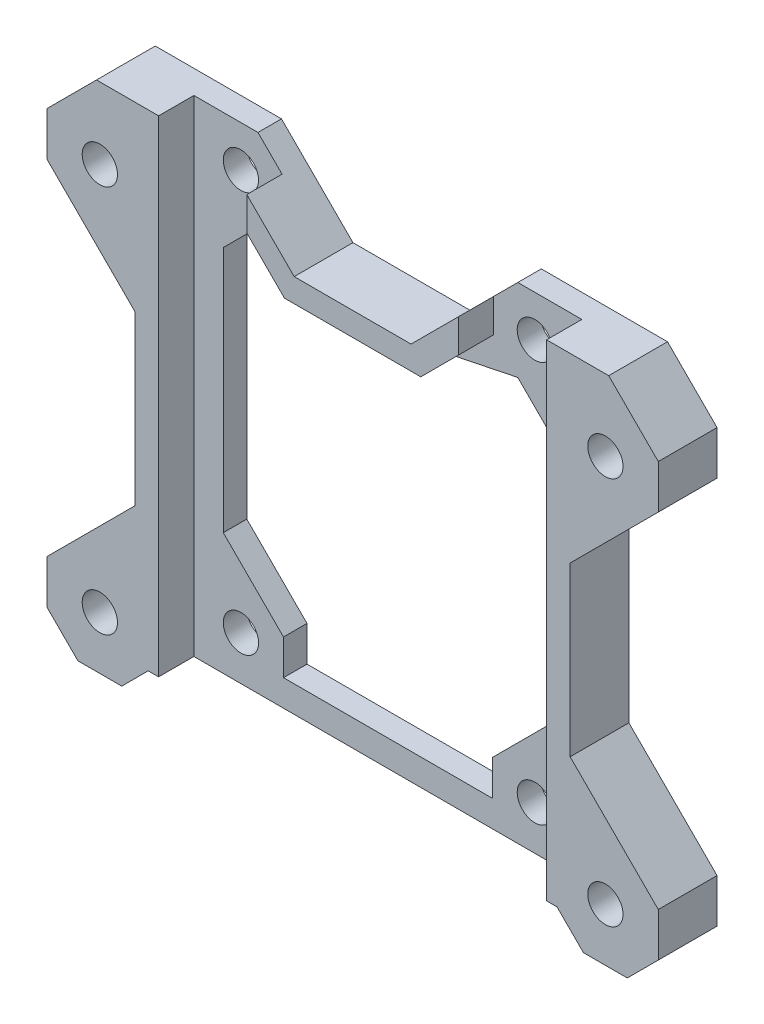
from build123d import *

# Parameters (mm, degrees)
SKETCH11_R          = 1.5
BOSS_EXTRUDE4_DEPTH = 2
SKETCH12_R          = 1.5
BOSS_EXTRUDE5_DEPTH = 3


with BuildPart() as part:
    # Sketch11 → Boss-Extrude4 (new body)
    with BuildSketch(Plane.XY):
        Polygon((16.5, -2.25), (-16.5, -2.25), (-17.386038969, -2.25), (-19.636038969, -4.5), (-23.363961031, -4.5), (-26, -1.863961031), (-26, 1.863961031), (-23.363961031, 4.5), (-18.5, 9.363961031), (-18.5, 23.636038969), (-23.363961031, 28.5), (-26, 31.136038969), (-26, 34.863961031), (-23.363961031, 37.5), (-21.784271247, 39.079689783), (-13.949747468, 39.079689783), (-11.050252532, 39.079689783), (-9, 37.029437252), (-4.970562748, 33), (4.970562748, 33), (9, 37.029437252), (11.050252532, 39.079689783), (13.949747468, 39.079689783), (21.784271247, 39.079689783), (23.363961031, 37.5), (26, 34.863961031), (26, 31.136038969), (23.363961031, 28.5), (18.5, 23.636038969), (18.5, 9.363961031), (23.363961031, 4.5), (26, 1.863961031), (26, -1.863961031), (23.363961031, -4.5), (19.636038969, -4.5), (17.386038969, -2.25), align=None)
        with Locations((-12.5, 1.5)):
            Circle(SKETCH11_R, mode=Mode.SUBTRACT)
        with Locations((-12.5, 35.579689783)):
            Circle(SKETCH11_R, mode=Mode.SUBTRACT)
        with Locations(Location((12.5, 35.579689783, 0), (0, 0, 180))):
            Circle(SKETCH11_R, mode=Mode.SUBTRACT)
        with Locations(Location((12.5, 1.5, 0), (0, 0, 180))):
            Circle(SKETCH11_R, mode=Mode.SUBTRACT)
        Polygon((8.878679656, 0), (-8.878679656, 0), (-8.878679656, 3), (-11, 5.121320344), (-14, 8.121320344), (-14, 29.129942315), (-11.050252532, 32.079689783), (-5.798989873, 31), (5.798989873, 31), (11.050252532, 32.079689783), (14, 29.129942315), (14, 8.121320344), (11, 5.121320344), (8.878679656, 3), align=None, mode=Mode.SUBTRACT)
    extrude(amount=BOSS_EXTRUDE4_DEPTH)

    # Sketch12 → Boss-Extrude5 (add)
    # profile 1 of 3: a face of its own
    with BuildSketch(Plane.XY.offset(2)):
        Polygon((-23.363961031, -4.5), (-19.636038969, -4.5), (-17.386038969, -2.25), (-16.5, -2.25), (-16.5, 39.079689783), (-21.784271247, 39.079689783), (-26, 34.863961031), (-26, 31.136038969), (-18.5, 23.636038969), (-18.5, 9.363961031), (-26, 1.863961031), (-26, -1.863961031), align=None)
        with Locations((-21.5, 0)):
            Circle(SKETCH12_R, mode=Mode.SUBTRACT)
        with Locations((-21.5, 33)):
            Circle(SKETCH12_R, mode=Mode.SUBTRACT)
    # profile 2 of 3: a face of its own
    with BuildSketch(Plane.XY.offset(2)):
        Polygon((-9, 37.029437252), (-9, 34.201010127), (-5.798989873, 31), (5.798989873, 31), (9, 34.201010127), (9, 37.029437252), (4.970562748, 33), (-4.970562748, 33), align=None)
    # profile 3 of 3: a face of its own
    with BuildSketch(Plane.XY.offset(2)):
        Polygon((16.5, 39.079689783), (16.5, -2.25), (17.386038969, -2.25), (19.636038969, -4.5), (23.363961031, -4.5), (26, -1.863961031), (26, 1.863961031), (18.5, 9.363961031), (18.5, 23.636038969), (26, 31.136038969), (26, 34.863961031), (21.784271247, 39.079689783), align=None)
        with Locations((21.5, 0)):
            Circle(SKETCH12_R, mode=Mode.SUBTRACT)
        with Locations((21.5, 33)):
            Circle(SKETCH12_R, mode=Mode.SUBTRACT)
    extrude(amount=BOSS_EXTRUDE5_DEPTH)


solid = part.part
